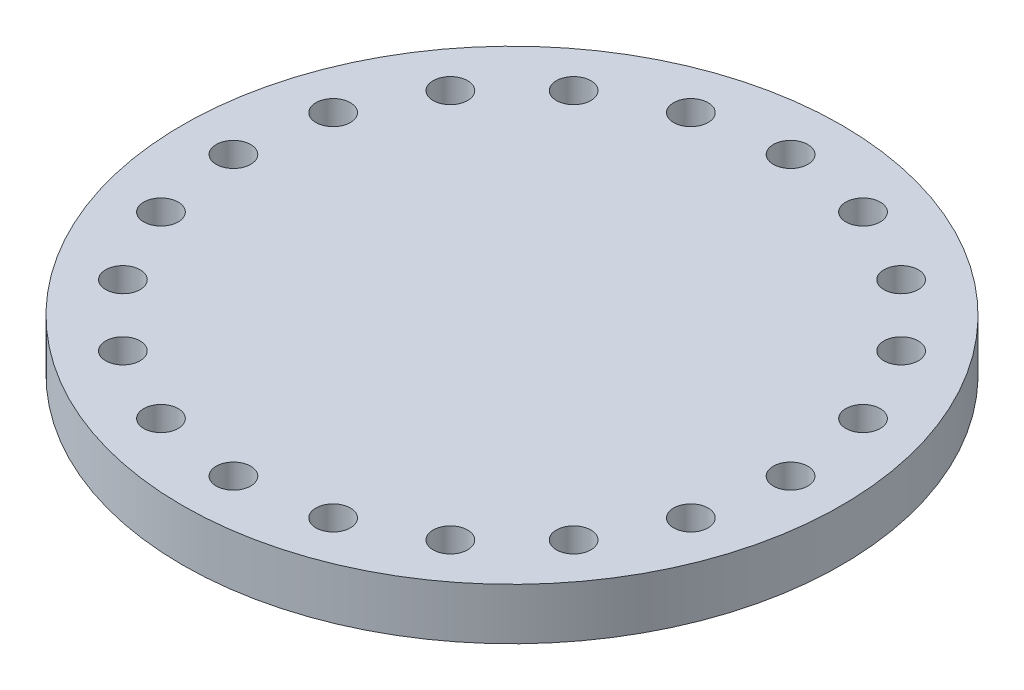
from build123d import *

# Parameters (mm, degrees)
SKETCH1_R           = 32
SKETCH1_R_2         = 1.675
BOSS_EXTRUDE1_DEPTH = 5


with BuildPart() as part:
    # Sketch1 → Boss-Extrude1 (new body)
    with BuildSketch(Plane(origin=(0, 0, 0), x_dir=(1, 0, 0), z_dir=(0, 1, 0))):
        with Locations(Location((0, 0, 0), (0, 0, 270))):
            Circle(SKETCH1_R)
        with Locations(Location((0, -27.05, 0), (0, 0, 270))):
            Circle(SKETCH1_R_2, mode=Mode.SUBTRACT)
        with Locations(Location((-8.358909698, -25.726078766, 0), (0, 0, 270))):
            Circle(SKETCH1_R_2, mode=Mode.SUBTRACT)
        with Locations(Location((-15.899591075, -21.883909698, 0), (0, 0, 270))):
            Circle(SKETCH1_R_2, mode=Mode.SUBTRACT)
        with Locations(Location((-21.883909698, -15.899591075, 0), (0, 0, 270))):
            Circle(SKETCH1_R_2, mode=Mode.SUBTRACT)
        with Locations(Location((-25.726078766, -8.358909698, 0), (0, 0, 270))):
            Circle(SKETCH1_R_2, mode=Mode.SUBTRACT)
        with Locations(Location((-27.05, 0, 0), (0, 0, 270))):
            Circle(SKETCH1_R_2, mode=Mode.SUBTRACT)
        with Locations(Location((-25.726078766, 8.358909698, 0), (0, 0, 270))):
            Circle(SKETCH1_R_2, mode=Mode.SUBTRACT)
        with Locations(Location((-21.883909698, 15.899591075, 0), (0, 0, 270))):
            Circle(SKETCH1_R_2, mode=Mode.SUBTRACT)
        with Locations(Location((-15.899591075, 21.883909698, 0), (0, 0, 270))):
            Circle(SKETCH1_R_2, mode=Mode.SUBTRACT)
        with Locations(Location((-8.358909698, 25.726078766, 0), (0, 0, 270))):
            Circle(SKETCH1_R_2, mode=Mode.SUBTRACT)
        with Locations(Location((0, 27.05, 0), (0, 0, 270))):
            Circle(SKETCH1_R_2, mode=Mode.SUBTRACT)
        with Locations(Location((8.358909698, 25.726078766, 0), (0, 0, 270))):
            Circle(SKETCH1_R_2, mode=Mode.SUBTRACT)
        with Locations(Location((15.899591075, 21.883909698, 0), (0, 0, 270))):
            Circle(SKETCH1_R_2, mode=Mode.SUBTRACT)
        with Locations(Location((21.883909698, 15.899591075, 0), (0, 0, 270))):
            Circle(SKETCH1_R_2, mode=Mode.SUBTRACT)
        with Locations(Location((25.726078766, 8.358909698, 0), (0, 0, 270))):
            Circle(SKETCH1_R_2, mode=Mode.SUBTRACT)
        with Locations(Location((27.05, 0, 0), (0, 0, 270))):
            Circle(SKETCH1_R_2, mode=Mode.SUBTRACT)
        with Locations(Location((25.726078766, -8.358909698, 0), (0, 0, 270))):
            Circle(SKETCH1_R_2, mode=Mode.SUBTRACT)
        with Locations(Location((21.883909698, -15.899591075, 0), (0, 0, 270))):
            Circle(SKETCH1_R_2, mode=Mode.SUBTRACT)
        with Locations(Location((15.899591075, -21.883909698, 0), (0, 0, 270))):
            Circle(SKETCH1_R_2, mode=Mode.SUBTRACT)
        with Locations(Location((8.358909698, -25.726078766, 0), (0, 0, 270))):
            Circle(SKETCH1_R_2, mode=Mode.SUBTRACT)
    extrude(amount=BOSS_EXTRUDE1_DEPTH)


solid = part.part
